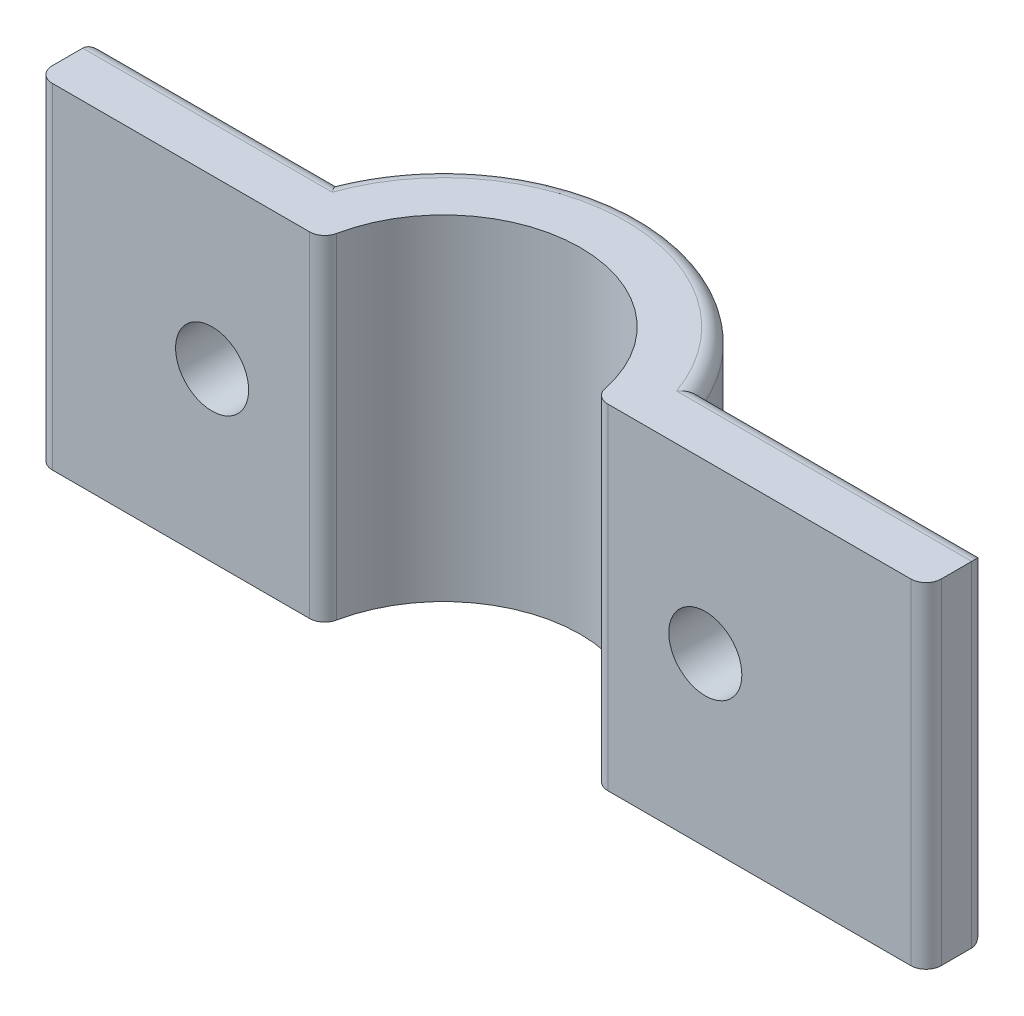
from build123d import *

# Parameters (mm, degrees)
BOSS_EXTRUDE1_DEPTH = 11
SKETCH2_R           = 1.2
CUT_EXTRUDE1_DEPTH  = 2
FILLET1_R           = 0.5


with BuildPart() as part:
    # Sketch1 → Boss-Extrude1 (new body)
    with BuildSketch(Plane(origin=(0, 0, 0), x_dir=(1, 0, 0), z_dir=(0, 1, 0))):
        with BuildLine():
            Line((6, 2.5), (15.35, 2.5))
            Line((15.35, 2.5), (15.35, 0.5))
            Line((15.35, 0.5), (6.480740698, 0.5))
            Line((6.480740698, 0.5), (4.472135955, 0.5))
            ThreePointArc((4.472135955, 0.5), (0, 4.5), (-4.472135955, 0.5))
            Line((-4.472135955, 0.5), (-6.480740698, 0.5))
            Line((-6.480740698, 0.5), (-13.85, 0.5))
            Line((-13.85, 0.5), (-13.85, 2.5))
            Line((-13.85, 2.5), (-6, 2.5))
            ThreePointArc((-6, 2.5), (0, 6.5), (6, 2.5))
        make_face()
    extrude(amount=BOSS_EXTRUDE1_DEPTH)

    # Sketch2 → Cut-Extrude1 (cut)
    with BuildSketch(Plane(origin=(0, 0, -2.5), x_dir=(-1, 0, 0), z_dir=(0, 0, -1))):
        with Locations((-8.1, 5.5)):
            Circle(SKETCH2_R)
        with Locations((8.1, 5.5)):
            Circle(SKETCH2_R)
    extrude(amount=-CUT_EXTRUDE1_DEPTH, mode=Mode.SUBTRACT)

    # Fillet1
    fillet1_edges = [part.edges().sort_by_distance(p)[0] for p in [
        (0, 11, -6.5),
        (-9.925, 0, -2.5),
        (0, 0, -6.5),
        (10.675, 0, -2.5),
        (-9.925, 11, -2.5),
        (15.35, 5.5, -2.5),
        (15.35, 5.5, -0.5),
        (4.472135955, 5.5, -0.5),
        (-4.472135955, 5.5, -0.5),
        (-13.85, 5.5, -0.5),
        (-13.85, 5.5, -2.5),
        (10.675, 11, -2.5),
    ]]
    fillet(fillet1_edges, radius=FILLET1_R)


solid = part.part
